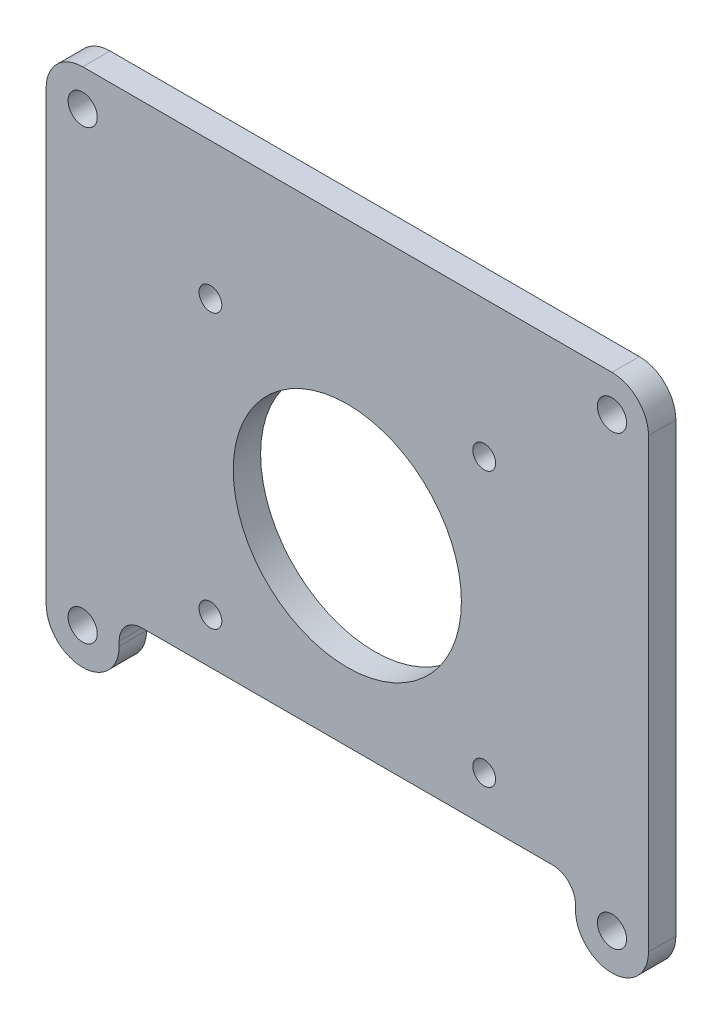
from build123d import *

# Parameters (mm, degrees)
SKETCH_1_R          = 1.6
EXTRUDE_1_DEPTH     = 3
SKETCH_2_R          = 1.25
SKETCH_2_R_2        = 12.5
CUT_EXTRUDE_1_DEPTH = 60.983331018


with BuildPart() as part:
    # ｽｹｯﾁ1 → ﾎﾞｽ - 押し出し1 (new body)
    with BuildSketch(Plane.XY):
        with BuildLine():
            Line((22.5, 0), (-22.5, 0))
            ThreePointArc((-22.5, 0), (-24.267766953, -0.732233047), (-25, -2.5))
            Line((-25, -2.5), (-25, -3))
            ThreePointArc((-25, -3), (-29, -7), (-33, -3))
            Line((-33, -3), (-33, 46))
            ThreePointArc((-33, 46), (-31.828427125, 48.828427125), (-29, 50))
            Line((-29, 50), (29, 50))
            ThreePointArc((29, 50), (31.828427125, 48.828427125), (33, 46))
            Line((33, 46), (33, -3))
            ThreePointArc((33, -3), (29, -7), (25, -3))
            Line((25, -3), (25, -2.5))
            ThreePointArc((25, -2.5), (24.267766953, -0.732233047), (22.5, 0))
        make_face()
        with Locations((-29, -3)):
            Circle(SKETCH_1_R, mode=Mode.SUBTRACT)
        with Locations((-29, 46)):
            Circle(SKETCH_1_R, mode=Mode.SUBTRACT)
        with Locations(Location((29, 46, 0), (0, 0, 180))):
            Circle(SKETCH_1_R, mode=Mode.SUBTRACT)
        with Locations(Location((29, -3, 0), (0, 0, 180))):
            Circle(SKETCH_1_R, mode=Mode.SUBTRACT)
    extrude(amount=EXTRUDE_1_DEPTH)

    # ｽｹｯﾁ2 → ｶｯﾄ - 押し出し1 (cut, through all)
    with BuildSketch(Plane.XY.offset(3)):
        with Locations((-15, 35)):
            Circle(SKETCH_2_R)
        with Locations((-15, 5)):
            Circle(SKETCH_2_R)
        with Locations((15, 5)):
            Circle(SKETCH_2_R)
        with Locations((15, 35)):
            Circle(SKETCH_2_R)
        with Locations((0, 20)):
            Circle(SKETCH_2_R_2)
    extrude(amount=-CUT_EXTRUDE_1_DEPTH, mode=Mode.SUBTRACT)


solid = part.part
